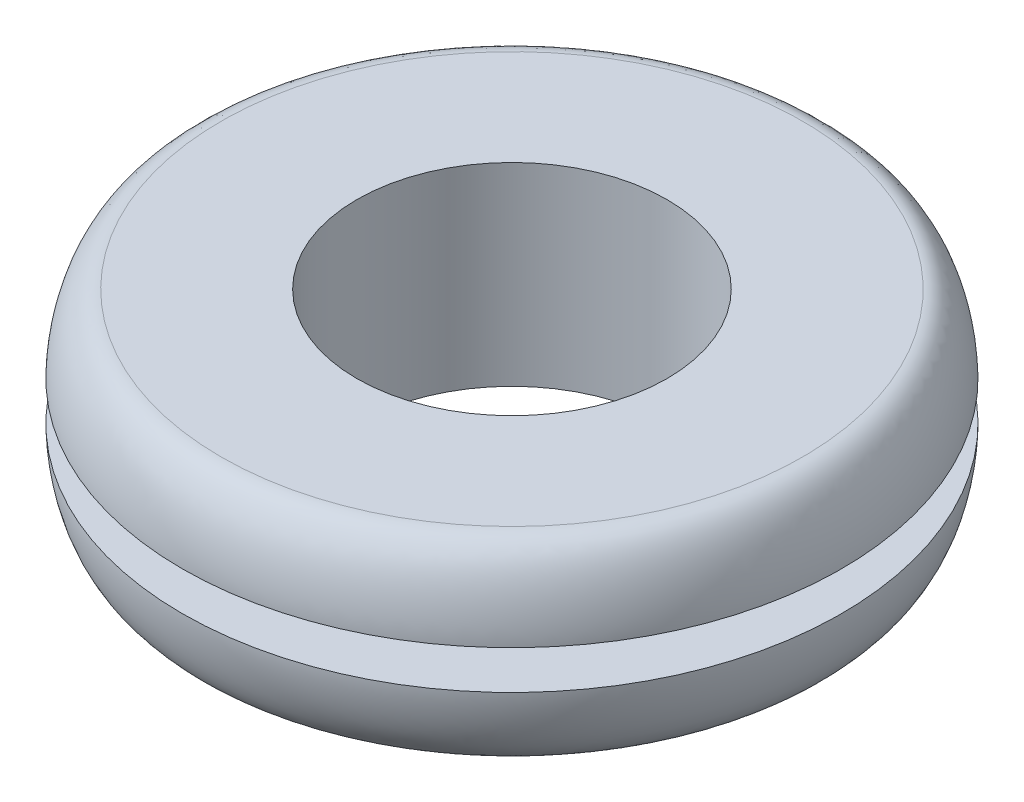
from build123d import *


with BuildPart() as part:
    # Sketch1 → Revolve1 (revolve)
    with BuildSketch(Plane.XY, mode=Mode.PRIVATE) as revolve1_sk:
        with BuildLine():
            Line((-6.35, 3.96875), (-6.35, -3.96875))
            Line((-6.35, -3.96875), (-11.90625, -3.96875))
            add(Edge.make_bspline(
                [(-11.90625, -3.96875), (-13.052015746, -3.96875), (-13.49375, -1.832832331), (-13.49375, -0.79375)],
                knots=[0, 0, 0, 0, 1, 1, 1, 1], degree=3))
            Line((-13.49375, -0.79375), (-10.31875, -0.79375))
            Line((-10.31875, -0.79375), (-10.31875, 0.79375))
            Line((-10.31875, 0.79375), (-13.49375, 0.79375))
            add(Edge.make_bspline(
                [(-11.90625, 3.96875), (-13.052015746, 3.96875), (-13.49375, 1.832832331), (-13.49375, 0.79375)],
                knots=[0, 0, 0, 0, 1, 1, 1, 1], degree=3))
            Line((-11.90625, 3.96875), (-6.35, 3.96875))
        make_face()
    revolve(revolve1_sk.sketch.rotate(Axis((0, 96.264631407, 0), (0, -1, 0)), 270), axis=Axis((0, 96.264631407, 0), (0, -1, 0)))


solid = part.part
